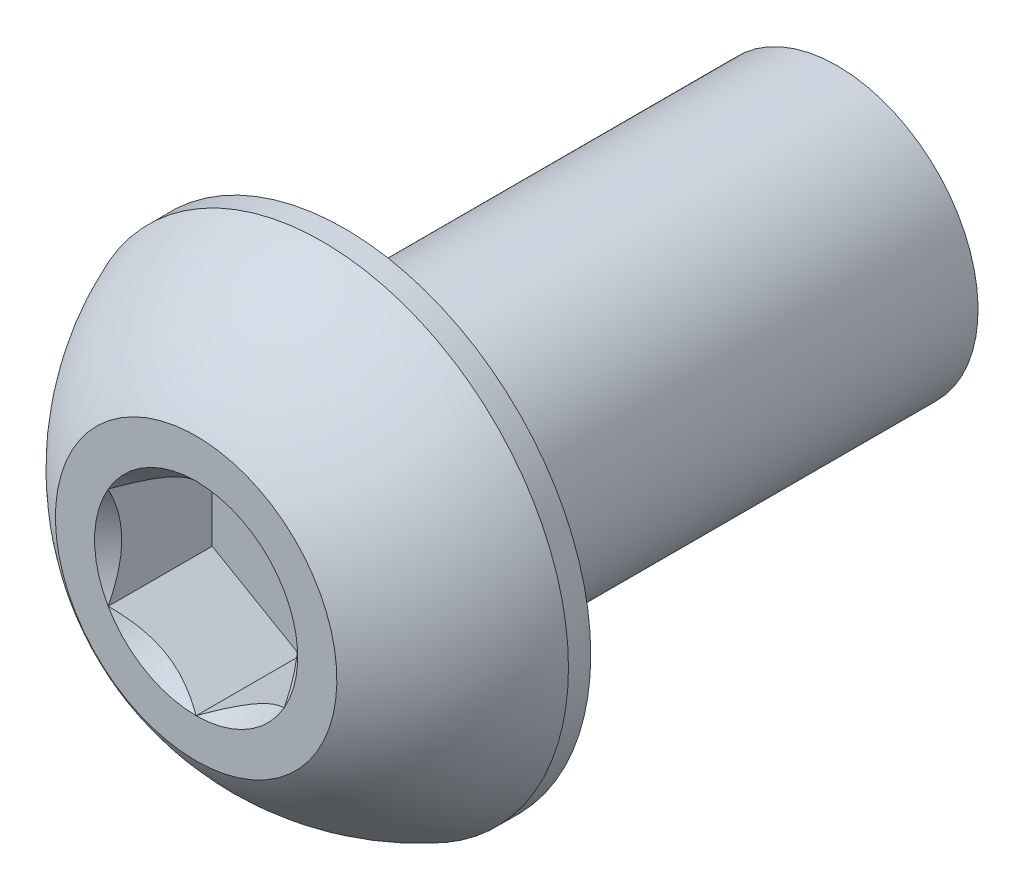
from build123d import *

# Parameters (mm, degrees)
SKETCH1_W          = 11.1125
SKETCH1_H          = 3.175
CUT_EXTRUDE2_DEPTH = 2.34696


with BuildPart() as part:
    # Sketch1 → Revolve1 (revolve)
    with BuildSketch(Plane(origin=(0, 0, 0), x_dir=(0, 0, -1), z_dir=(1, 0, 0))):
        with Locations((8.90905, 1.5875)):
            Rectangle(SKETCH1_W, SKETCH1_H)
    revolve(axis=Axis((0, 0, -14.4653), (0, 0, 1)))

    # Sketch7 → Revolve2 (revolve)
    with BuildSketch(Plane(origin=(0, 0, 0), x_dir=(0, 0, -1), z_dir=(1, 0, 0)), mode=Mode.PRIVATE) as revolve2_sk:
        with BuildLine():
            Line((2.84988, 5.5499), (3.3528, 5.5499))
            Line((3.3528, 5.5499), (3.3528, 0))
            Line((3.3528, 0), (0, 0))
            Line((0, 0), (0, 3.175))
            ThreePointArc((0, 3.175), (1.235921075, 4.58927271), (2.84988, 5.5499))
        make_face()
    revolve(revolve2_sk.sketch.rotate(Axis((0, 0, 0), (0, 0, -1)), 180), axis=Axis((0, 0, 0), (0, 0, -1)))

    # Sketch5 → Cut-Extrude2 (cut)
    with BuildSketch(Plane.XY):
        Polygon((1.984375, -1.14567944), (1.984375, 1.14567944), (0, 2.291358881), (-1.984375, 1.14567944), (-1.984375, -1.14567944), (0, -2.291358881), align=None)
    extrude(amount=-CUT_EXTRUDE2_DEPTH, mode=Mode.SUBTRACT)

    # Cut-Extrude3 cone 1 section (through the dimple's axis) → Cut-Extrude3 (revolve, cut)
    with BuildSketch(Plane(origin=(0, 0, 0), x_dir=(0, -1, 0), z_dir=(1, 0, 0))):
        Polygon((0, 0), (2.291358881, 0), (0, 2.291358881), align=None)
    revolve(axis=Axis((0, 0, 0), (0, 0, -1)), mode=Mode.SUBTRACT)


solid = part.part
